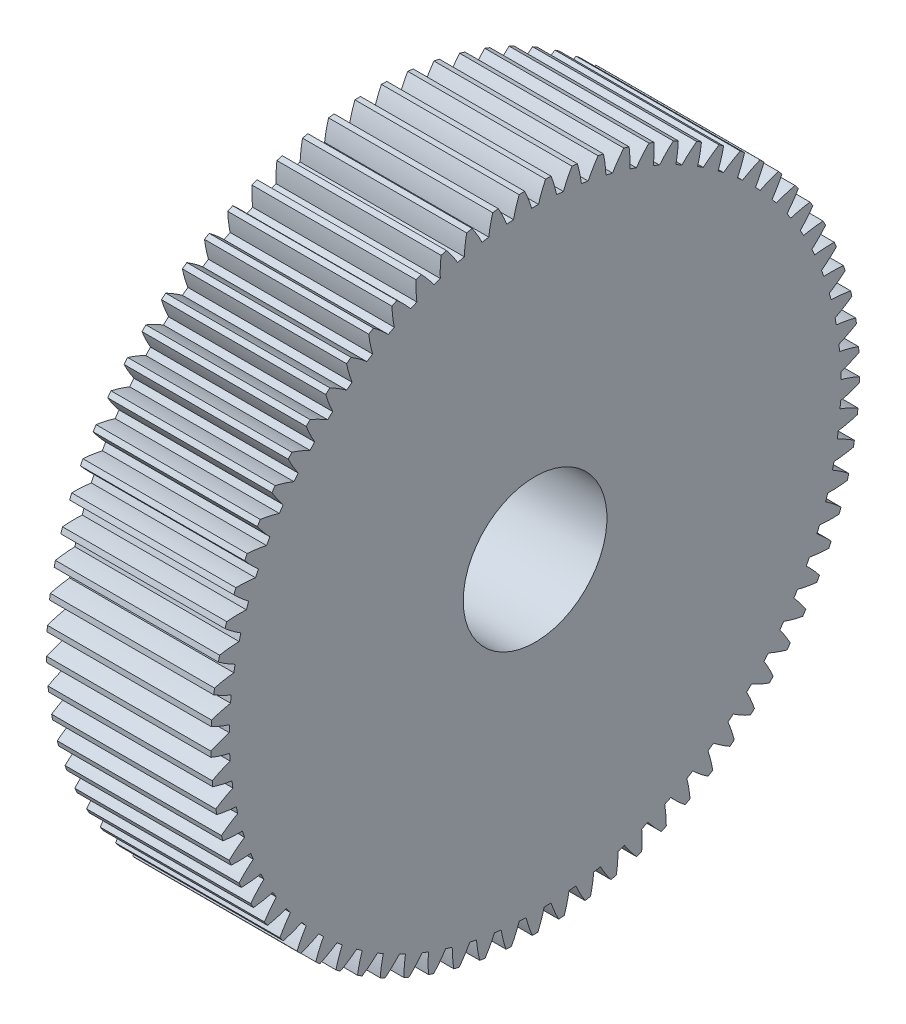
from build123d import *

# Parameters (mm, degrees)
BASPROSKE_W     = 40
BASPROSKE_H     = 79
TOOTHCUT_DEPTH  = 119.667602993
TEETHCUTS_COUNT = 77
TEETHCUTS_ANGLE = 355.324675325
BORSKE_R        = 17.5
BORE_DEPTH      = 50.0000508


with BuildPart() as part:
    # BasProSke → Base-Revolve (revolve)
    with BuildSketch(Plane(origin=(0, 0, 0), x_dir=(1, 0, 0), z_dir=(0, 1, 0)), mode=Mode.PRIVATE) as base_revolve_sk:
        with Locations((20, 39.5)):
            Rectangle(BASPROSKE_W, BASPROSKE_H)
    revolve(base_revolve_sk.sketch.rotate(Axis((-10, 0, 0), (1, 0, 0)), 180), axis=Axis((-10, 0, 0), (1, 0, 0)))

    # TooCutSke → ToothCut (cut, through all)
    with BuildSketch(Plane(origin=(0, 0, 0), x_dir=(0, 0, -1), z_dir=(1, 0, 0))):
        with BuildLine():
            ThreePointArc((0.828436486, 74.494393708), (0, 74.499), (-0.828436486, 74.494393708))
            ThreePointArc((-0.828436486, 74.494393708), (-1.606636837, 76.77302844), (-2.560460171, 78.98390905))
            ThreePointArc((-2.560460171, 78.98390905), (0, 79.0254), (2.560460171, 78.98390905))
            ThreePointArc((2.560460171, 78.98390905), (1.606636837, 76.77302844), (0.828436486, 74.494393708))
        make_face()
    toothcut = extrude(amount=TOOTHCUT_DEPTH, mode=Mode.SUBTRACT)

    # TeethCuts: ToothCut ×77 about axis
    teethcuts_axis = Axis((-10, 0, 0), (1, 0, 0))
    for i in range(1, TEETHCUTS_COUNT):
        add(toothcut.rotate(teethcuts_axis, i * TEETHCUTS_ANGLE / (TEETHCUTS_COUNT - 1)), mode=Mode.SUBTRACT)

    # BorSke → Bore (cut, symmetric)
    with BuildSketch(Plane(origin=(0, 0, 0), x_dir=(0, 0, -1), z_dir=(1, 0, 0))):
        with Locations(Location((0, 0, 0), (0, 0, 180))):
            Circle(BORSKE_R)
    extrude(amount=BORE_DEPTH, both=True, mode=Mode.SUBTRACT)


solid = part.part
